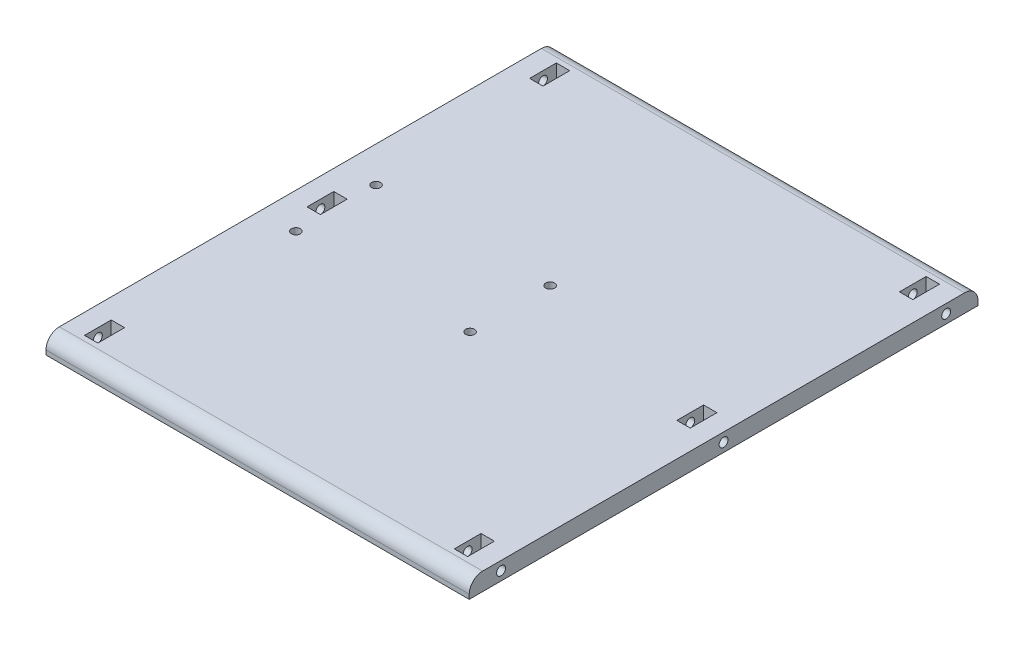
from build123d import *

# Parameters (mm, degrees)
ESQUISSE1_W             = 95.08
ESQUISSE1_H             = 114.3
ESQUISSE1_R             = 1
ESQUISSE1_W_2           = 3
ESQUISSE1_H_2           = 6
BOSS_EXTRU_1_DEPTH      = 4
ESQUISSE2_R             = 1
ENL_V_MAT_EXTRU_1_DEPTH = 10
ENL_V_START             = -10
ESQUISSE3_R             = 1
ENL_V_MAT_EXTRU_2_DEPTH = 10
CONG_1_R                = 3


with BuildPart() as part:
    # Esquisse1 → Boss.-Extru.1 (new body)
    with BuildSketch(Plane(origin=(0, 0, 0), x_dir=(1, 0, 0), z_dir=(0, 1, 0))):
        Rectangle(ESQUISSE1_W, ESQUISSE1_H)
        with Locations(Location((-39.54, -9, 0), (0, 0, 270))):
            Circle(ESQUISSE1_R, mode=Mode.SUBTRACT)
        with Locations(Location((-0.42, -9, 0), (0, 0, 270))):
            Circle(ESQUISSE1_R, mode=Mode.SUBTRACT)
        with Locations(Location((-0.42, 9, 0), (0, 0, 90))):
            Circle(ESQUISSE1_R, mode=Mode.SUBTRACT)
        with Locations(Location((-39.54, 9, 0), (0, 0, 90))):
            Circle(ESQUISSE1_R, mode=Mode.SUBTRACT)
        with Locations((41.54, 0)):
            Rectangle(ESQUISSE1_W_2, ESQUISSE1_H_2, mode=Mode.SUBTRACT)
        with Locations((41.54, -50)):
            Rectangle(ESQUISSE1_W_2, ESQUISSE1_H_2, mode=Mode.SUBTRACT)
        with Locations((41.54, 50)):
            Rectangle(ESQUISSE1_W_2, ESQUISSE1_H_2, mode=Mode.SUBTRACT)
        with Locations((-41.54, -50)):
            Rectangle(ESQUISSE1_W_2, ESQUISSE1_H_2, mode=Mode.SUBTRACT)
        with Locations((-41.54, 50)):
            Rectangle(ESQUISSE1_W_2, ESQUISSE1_H_2, mode=Mode.SUBTRACT)
        with Locations((-41.54, 0)):
            Rectangle(ESQUISSE1_W_2, ESQUISSE1_H_2, mode=Mode.SUBTRACT)
    extrude(amount=BOSS_EXTRU_1_DEPTH)

    # Esquisse2 → Enlèv. mat.-Extru.1 (cut)
    with BuildSketch(Plane.ZY.offset(47.54)):
        with Locations((-50, 2)):
            Circle(ESQUISSE2_R)
        with Locations((0, 2)):
            Circle(ESQUISSE2_R)
        with Locations((50, 2)):
            Circle(ESQUISSE2_R)
    extrude(amount=-ENL_V_MAT_EXTRU_1_DEPTH, mode=Mode.SUBTRACT)

    # Esquisse3 → Enlèv. mat.-Extru.2 (cut)
    with BuildSketch(Plane(origin=(47.54, 0, 0), x_dir=(0, 0, -1), z_dir=(1, 0, 0)).offset(ENL_V_START)):
        with Locations(Location((-50, 2, 0), (0, 0, 180))):
            Circle(ESQUISSE3_R)
        with Locations(Location((0, 2, 0), (0, 0, 180))):
            Circle(ESQUISSE3_R)
        with Locations(Location((50, 2, 0), (0, 0, 180))):
            Circle(ESQUISSE3_R)
    extrude(amount=ENL_V_MAT_EXTRU_2_DEPTH, mode=Mode.SUBTRACT)

    # Congé1
    cong_1_edges = [part.edges().sort_by_distance(p)[0] for p in [
        (0, 4, 57.15),
        (0, 4, -57.15),
    ]]
    fillet(cong_1_edges, radius=CONG_1_R)


solid = part.part
